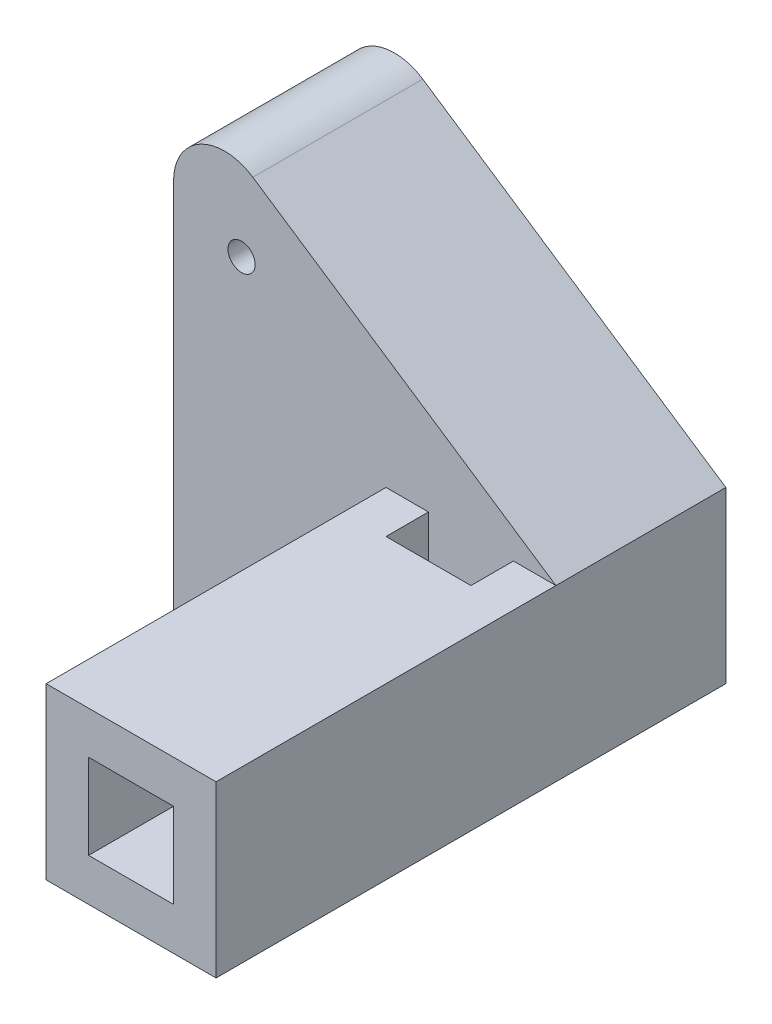
from build123d import *

# Parameters (mm, degrees)
SKETCH_1_W          = 20
SKETCH_1_H          = 20
SKETCH_1_W_2        = 10
SKETCH_1_H_2        = 10
EXTRUDE_1_DEPTH     = 60
SKETCH_2_W          = 10
SKETCH_2_H          = 5
CUT_EXTRUDE_1_DEPTH = 80
SKETCH_4_R          = 1.6
EXTRUDE_3_DEPTH     = 20
CHAMFER_1_SIZE      = 1


with BuildPart() as part:
    # 草图1 → 凸台-拉伸1 (new body)
    with BuildSketch(Plane.XY):
        with Locations((5, 5)):
            Rectangle(SKETCH_1_W, SKETCH_1_H)
        with Locations((5, 5)):
            Rectangle(SKETCH_1_W_2, SKETCH_1_H_2, mode=Mode.SUBTRACT)
    extrude(amount=EXTRUDE_1_DEPTH)

    # 草图2 → 切除-拉伸1 (cut)
    with BuildSketch(Plane(origin=(0, 15, 0), x_dir=(1, 0, 0), z_dir=(0, 1, 0))):
        with Locations((5, -22.5)):
            Rectangle(SKETCH_2_W, SKETCH_2_H)
    extrude(amount=-CUT_EXTRUDE_1_DEPTH, mode=Mode.SUBTRACT)

    # 草图4 → 凸台-拉伸3 (add)
    with BuildSketch(Plane(origin=(0, 0, 0), x_dir=(-1, 0, 0), z_dir=(0, 0, -1))):
        with BuildLine():
            Line((30, 33.788897449), (30, -23.788897449))
            ThreePointArc((30, -23.788897449), (26.831147553, -29.078945042), (20.671798823, -28.781199215))
            Line((20.671798823, -28.781199215), (-15, -5))
            Line((-15, -5), (5, -5))
            Line((5, -5), (5, 15))
            Line((5, 15), (-15, 15))
            Line((-15, 15), (20.671798823, 38.781199215))
            ThreePointArc((20.671798823, 38.781199215), (26.831147553, 39.078945042), (30, 33.788897449))
        make_face()
        with Locations((22, -20)):
            Circle(SKETCH_4_R, mode=Mode.SUBTRACT)
        with Locations((22, 30)):
            Circle(SKETCH_4_R, mode=Mode.SUBTRACT)
    extrude(amount=-EXTRUDE_3_DEPTH)

    # 倒角1
    chamfer_1_edges = [part.edges().sort_by_distance(p)[0] for p in [
        (0, 5, 0),
        (5, 0, 0),
        (10, 5, 0),
        (5, 10, 0),
    ]]
    chamfer(chamfer_1_edges, length=CHAMFER_1_SIZE)


solid = part.part
